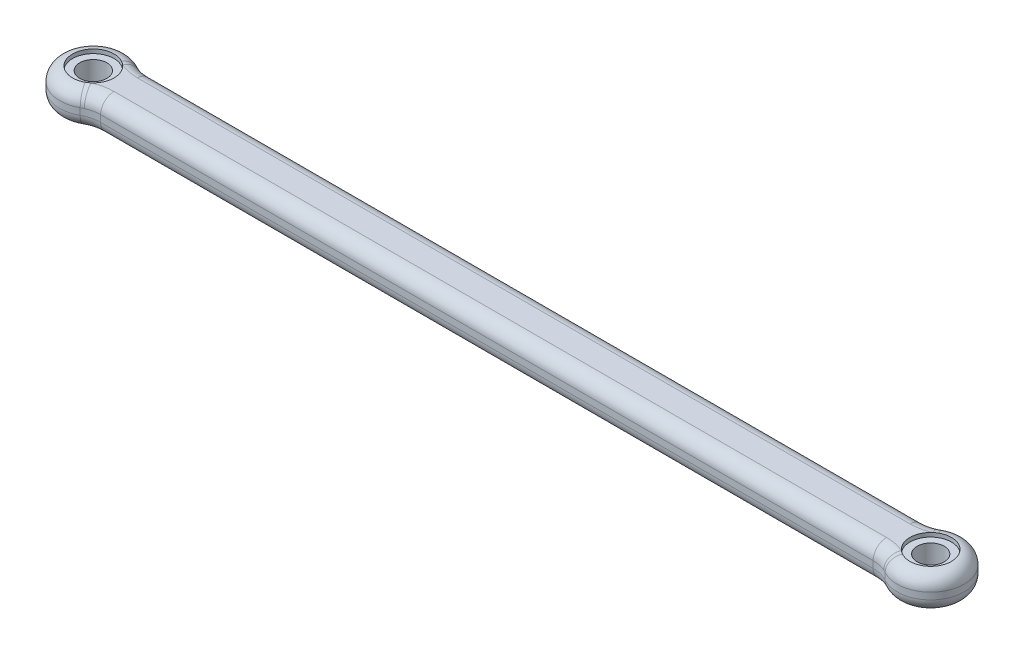
from build123d import *

# Parameters (mm, degrees)
SALIENTE_EXTRUIR1_DEPTH                              = 5
REFRENTADO_PARA_TORNILLO_CON_CABEZA_PLAN_D           = 8.1
REFRENTADO_PARA_TORNILLO_CON_CABEZA_PLAN_CBORE_D     = 12.4
REFRENTADO_PARA_TORNILLO_CON_CABEZA_PLAN_CBORE_DEPTH = 1.2
REDONDEO7_R                                          = 10
REDONDEO6_R                                          = 4


with BuildPart() as part:
    # Croquis1 → Saliente-Extruir1 (new, symmetric)
    with BuildSketch(Plane(origin=(0, 0, 0), x_dir=(-1, 0, 0), z_dir=(0, 1, 0))):
        with BuildLine():
            Line((6.614378278, -7.5), (243.385621722, -7.5))
            ThreePointArc((243.385621722, -7.5), (260, 0), (243.385621722, 7.5))
            Line((243.385621722, 7.5), (6.614378278, 7.5))
            ThreePointArc((6.614378278, 7.5), (-10, 0), (6.614378278, -7.5))
        make_face()
    extrude(amount=SALIENTE_EXTRUIR1_DEPTH, both=True)

    # Refrentado para tornillo con cabeza plana de M81 (through all)
    with Locations(Plane(origin=(0, 5, 0), x_dir=(-1, 0, 0), z_dir=(0, 1, 0))):
        with Locations((0, 0), (250, 0)):
            CounterBoreHole(REFRENTADO_PARA_TORNILLO_CON_CABEZA_PLAN_D / 2, REFRENTADO_PARA_TORNILLO_CON_CABEZA_PLAN_CBORE_D / 2, REFRENTADO_PARA_TORNILLO_CON_CABEZA_PLAN_CBORE_DEPTH)

    # Redondeo7
    redondeo7_edges = [part.edges().sort_by_distance(p)[0] for p in [
        (-243.385621722, 0, -7.5),
        (-6.614378278, 0, -7.5),
        (-6.614378278, 0, 7.5),
        (-243.385621722, 0, 7.5),
    ]]
    fillet(redondeo7_edges, radius=REDONDEO7_R)

    # Redondeo6
    redondeo6_edges = [part.edges().sort_by_distance(p)[0] for p in [
        (-260, -5, 0),
        (-125, 5, 7.5),
        (-125, -5, 7.5),
        (-125, 5, -7.5),
        (-125, -5, -7.5),
        (-7.182458366, -5, -7.817541634),
        (-7.182458366, -5, 7.817541634),
        (-242.817541634, -5, 7.817541634),
        (-242.817541634, -5, -7.817541634),
        (-7.182458366, 5, -7.817541634),
        (-7.182458366, 5, 7.817541634),
        (-242.817541634, 5, 7.817541634),
        (-242.817541634, 5, -7.817541634),
        (10, -5, 0),
    ]]
    fillet(redondeo6_edges, radius=REDONDEO6_R)


solid = part.part
